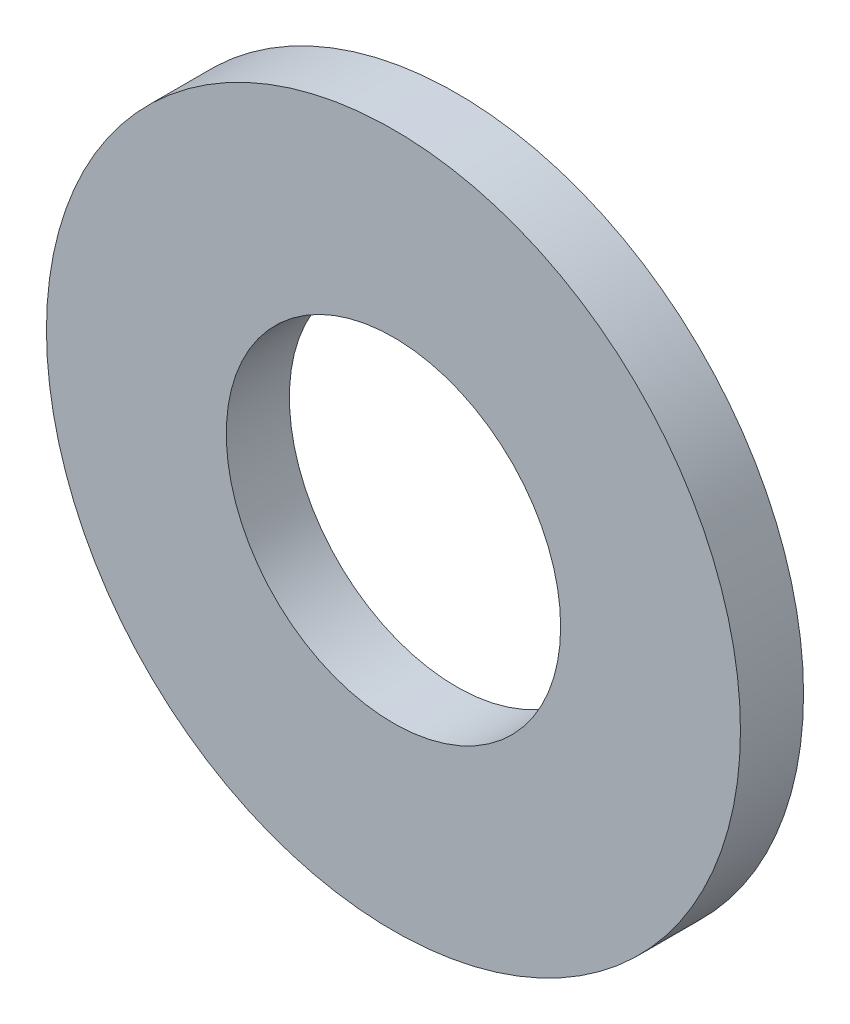
from build123d import *

# Parameters (mm, degrees)
SKETCH1_R           = 5.5
SKETCH1_R_2         = 2.65
BOSS_EXTRUDE1_DEPTH = 1


with BuildPart() as part:
    # Sketch1 → Boss-Extrude1 (new body)
    with BuildSketch(Plane.XY):
        Circle(SKETCH1_R)
        Circle(SKETCH1_R_2, mode=Mode.SUBTRACT)
    extrude(amount=BOSS_EXTRUDE1_DEPTH)


solid = part.part
